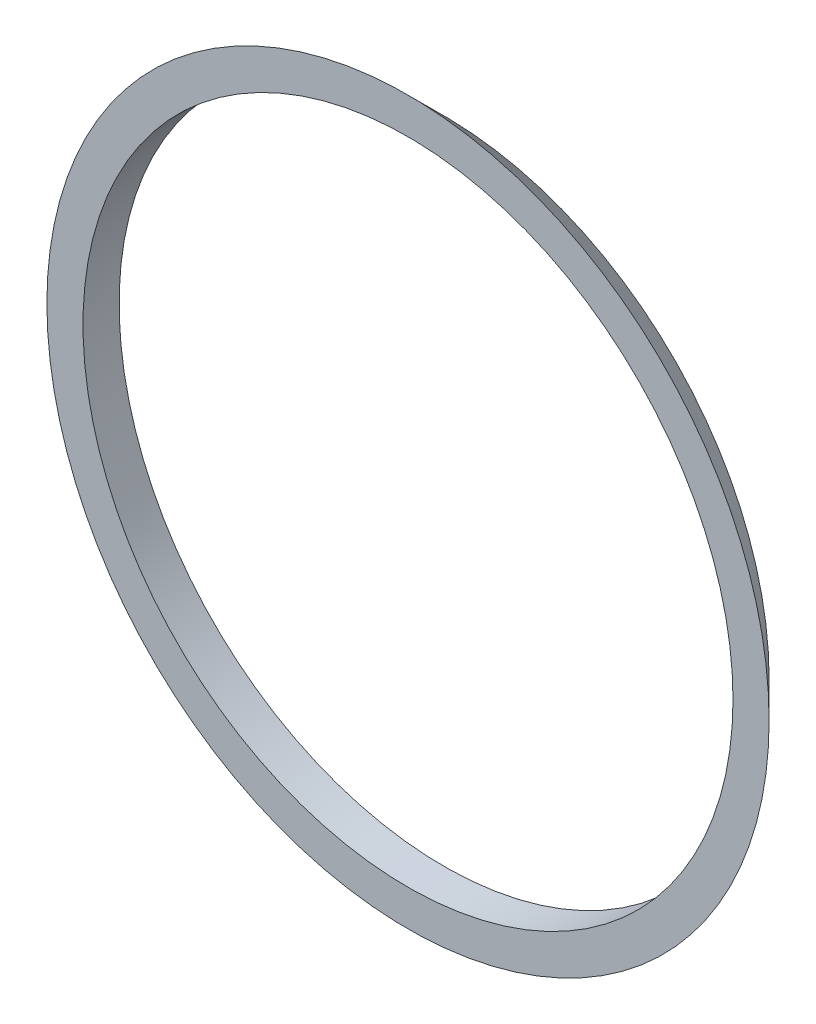
from build123d import *


with BuildPart() as part:
    # Sketch1 → Revolve1 (revolve)
    with BuildSketch(Plane(origin=(0, 0, 0), x_dir=(0, 0, -1), z_dir=(1, 0, 0)), mode=Mode.PRIVATE) as revolve1_sk:
        Polygon((0, 18), (0, 20), (2, 18), align=None)
    revolve(revolve1_sk.sketch.rotate(Axis((0, 0, 0), (0, 0, -1)), 90), axis=Axis((0, 0, 0), (0, 0, -1)))


solid = part.part
